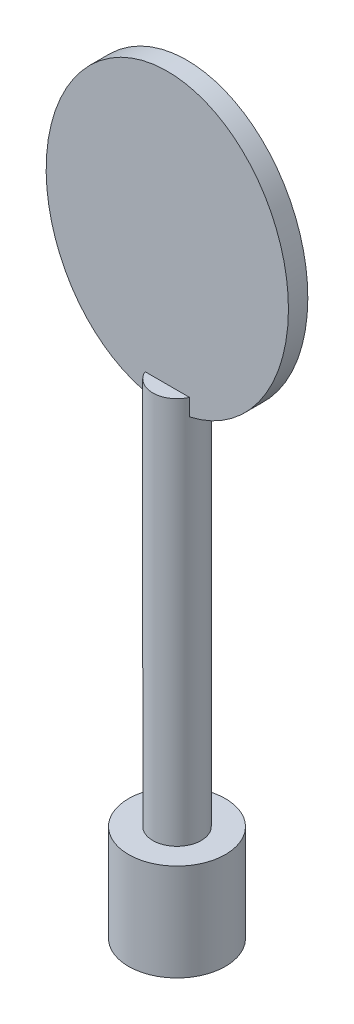
from build123d import *

# Parameters (mm, degrees)
SKETCH_1_R      = 50
EXTRUDE_1_DEPTH = 100
SKETCH_2_R      = 25
EXTRUDE_2_DEPTH = 400
SKETCH_3_RX     = 150
SKETCH_3_RY     = 125
EXTRUDE_3_DEPTH = 10


with BuildPart() as part:
    # 草图1 → 凸台-拉伸1 (new body)
    with BuildSketch(Plane(origin=(0, 0, 0), x_dir=(1, 0, 0), z_dir=(0, 1, 0))):
        with Locations(Location((0, 0, 0), (0, 0, 270))):
            Circle(SKETCH_1_R)
    extrude(amount=EXTRUDE_1_DEPTH)

    # 草图2 → 凸台-拉伸2 (add)
    with BuildSketch(Plane(origin=(0, 100, 0), x_dir=(1, 0, 0), z_dir=(0, 1, 0))):
        with Locations(Location((0, 0, 0), (0, 0, 270))):
            Circle(SKETCH_2_R)
    extrude(amount=EXTRUDE_2_DEPTH)

    # 草图3 → 凸台-拉伸3 (add, symmetric)
    with BuildSketch(Plane.XY):
        with Locations(Location((0, 630), (0, 0, 90))):
            Ellipse(SKETCH_3_RX, SKETCH_3_RY)
    extrude(amount=EXTRUDE_3_DEPTH, both=True)


solid = part.part
